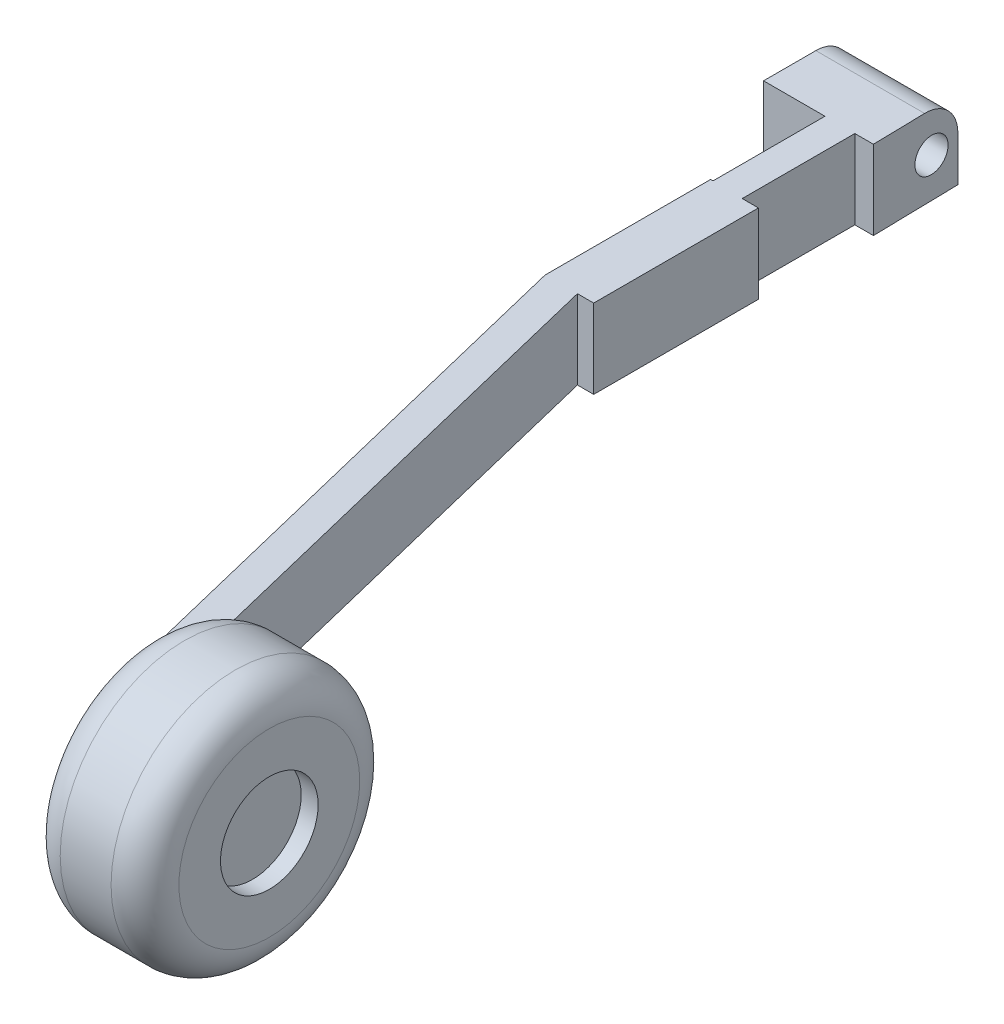
from build123d import *

# Parameters (mm, degrees)
BOSS_EXTRUDE1_DEPTH = 3.5
SKETCH2_R           = 1.5
CUT_EXTRUDE1_DEPTH  = 27
SKETCH8_R           = 1.5
BOSS_EXTRUDE6_DEPTH = 1.5
SKETCH9_R           = 11
BOSS_EXTRUDE7_DEPTH = 10.5
FILLET11_R          = 3
FILLET12_R          = 3
SKETCH12_R          = 4.31867217
CUT_EXTRUDE2_DEPTH  = 1.5


with BuildPart() as part:
    # Sketch1 → Boss-Extrude1 (new, symmetric)
    with BuildSketch(Plane(origin=(0, 0, 0), x_dir=(1, 0, 0), z_dir=(0, 1, 0))):
        Polygon((-14.755737993, 80.374354469), (-9.325152651, 80.374354469), (-9.325152651, 70.474186712), (-9.539422483, 70.474186712), (-9.539422483, 55.832207765), (3.525320524, 2.274676859), (5.509138823, 2.274676859), (5.509138823, 5.883287993), (-6.679961691, 55.832207765), (-5.241843463, 55.832207765), (-5.241843463, 70.40730195), (-6.679961691, 70.40730195), (-6.679961691, 72.014475303), (-6.679961691, 80.374354469), (-5.036944489, 80.374354469), (-5.196098726, 88), (-14.755737993, 88), align=None)
    extrude(amount=BOSS_EXTRUDE1_DEPTH, both=True)

    # Sketch2 → Cut-Extrude1 (cut)
    with BuildSketch(Plane.ZY.offset(14.755737993)):
        with Locations((-85.621539819, 0)):
            Circle(SKETCH2_R)
    extrude(amount=-CUT_EXTRUDE1_DEPTH, mode=Mode.SUBTRACT)

    # Sketch8 → Boss-Extrude6 (add)
    with BuildSketch(Plane(origin=(5.509138823, 0, 0), x_dir=(0, 0, -1), z_dir=(1, 0, 0))):
        with Locations(Location((4.384839861, 0, 0), (0, 0, 2.606494438))):
            Circle(SKETCH8_R)
    extrude(amount=BOSS_EXTRUDE6_DEPTH)

    # Sketch9 → Boss-Extrude7 (add)
    with BuildSketch(Plane(origin=(7.009138823, 0, 0), x_dir=(0, 0, -1), z_dir=(1, 0, 0))):
        with Locations((4.384839861, 0)):
            Circle(SKETCH9_R)
    extrude(amount=BOSS_EXTRUDE7_DEPTH)

    # Fillet11
    fillet11_edges = [part.edges().sort_by_distance(p)[0] for p in [
        (-9.97591836, 3.5, -88),
    ]]
    fillet(fillet11_edges, radius=FILLET11_R)

    # Fillet12
    fillet12_edges = [part.edges().sort_by_distance(p)[0] for p in [
        (7.009138823, 0, 6.615160139),
        (17.509138823, 0, 6.615160139),
    ]]
    fillet(fillet12_edges, radius=FILLET12_R)

    # Sketch12 → Cut-Extrude2 (cut)
    with BuildSketch(Plane(origin=(17.509138823, 0, 0), x_dir=(0, 0, -1), z_dir=(1, 0, 0))):
        with Locations((4.384839861, 0)):
            Circle(SKETCH12_R)
    extrude(amount=-CUT_EXTRUDE2_DEPTH, mode=Mode.SUBTRACT)


solid = part.part
